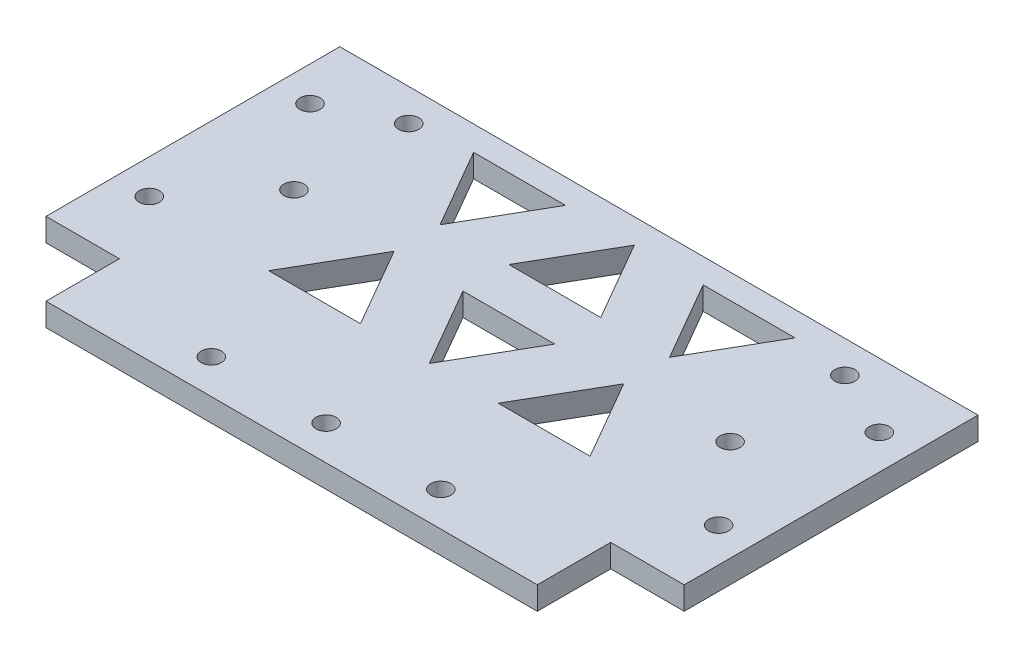
from build123d import *

# Parameters (mm, degrees)
SKETCH1_W               = 139
SKETCH1_H               = 160
BOSS_EXTRUDE1_DEPTH     = 5
SKETCH2_W               = 16
SKETCH2_H               = 16
CUT_EXTRUDE1_DEPTH      = 107.090763029
SKETCH3_R               = 2.2
CUT_EXTRUDE2_DEPTH      = 107.090763029
SKETCH4_R               = 2.2
CUT_EXTRUDE3_DEPTH      = 107.090763029
LPATTERN1_COUNT         = 4
LPATTERN1_PITCH         = 35
MIRROR2_COPY_1_SKETCH_R = 2.2
MIRROR2_COPY_1_DEPTH    = 107.090763029
MIRROR2_COPY_2_SKETCH_R = 2.2
MIRROR2_COPY_2_DEPTH    = 107.090763029
MIRROR2_COPY_3_SKETCH_R = 2.2
MIRROR2_COPY_3_DEPTH    = 107.090763029
SKETCH5_R               = 2.2
CUT_EXTRUDE4_DEPTH      = 107.090763029
CUT_EXTRUDE5_DEPTH      = 107.090763029
SKETCH9_W               = 139
SKETCH9_H               = 80
CUT_EXTRUDE6_DEPTH      = 10


with BuildPart() as part:
    # Sketch1 → Boss-Extrude1 (new body)
    with BuildSketch(Plane(origin=(0, 0, 0), x_dir=(1, 0, 0), z_dir=(0, 1, 0))):
        Rectangle(SKETCH1_W, SKETCH1_H)
    extrude(amount=BOSS_EXTRUDE1_DEPTH)

    # Sketch2 → Cut-Extrude1 (cut, through all)
    with BuildSketch(Plane(origin=(0, 5, 0), x_dir=(1, 0, 0), z_dir=(0, 1, 0))):
        with Locations((-61.5, -72)):
            Rectangle(SKETCH2_W, SKETCH2_H)
    cut_extrude1 = extrude(amount=-CUT_EXTRUDE1_DEPTH, mode=Mode.SUBTRACT)

    # Mirror1: Cut-Extrude1 across plane
    add(cut_extrude1.mirror(Plane(origin=(0, 0, 0), x_dir=(0, 0, 1), z_dir=(1, 0, 0))), mode=Mode.SUBTRACT)

    # Sketch3 → Cut-Extrude2 (cut, through all)
    with BuildSketch(Plane(origin=(0, 5, 0), x_dir=(1, 0, 0), z_dir=(0, 1, 0))):
        with Locations(Location((0, -72.5, 0), (0, 0, 270))):
            Circle(SKETCH3_R)
        with Locations(Location((-25, -72.5, 0), (0, 0, 270))):
            Circle(SKETCH3_R)
        with Locations(Location((25, -72.5, 0), (0, 0, 270))):
            Circle(SKETCH3_R)
    extrude(amount=-CUT_EXTRUDE2_DEPTH, mode=Mode.SUBTRACT)

    # Sketch4 → Cut-Extrude3 (cut, through all)
    with BuildSketch(Plane(origin=(0, 5, 0), x_dir=(1, 0, 0), z_dir=(0, 1, 0))):
        with Locations(Location((-62, -49, 0), (0, 0, 270))):
            Circle(SKETCH4_R)
    cut_extrude3 = extrude(amount=-CUT_EXTRUDE3_DEPTH, mode=Mode.SUBTRACT)

    # LPattern1: Cut-Extrude3 ×4
    with Locations(*[(0, 0, -i * LPATTERN1_PITCH) for i in range(1, LPATTERN1_COUNT)]):
        add(cut_extrude3, mode=Mode.SUBTRACT)

    # Mirror2: Cut-Extrude3 across plane
    add(cut_extrude3.mirror(Plane(origin=(0, 0, 0), x_dir=(0, 0, 1), z_dir=(1, 0, 0))), mode=Mode.SUBTRACT)

    # Mirror2 copy 1 sketch → Mirror2 copy 1 (cut, through all)
    with BuildSketch(Plane(origin=(0, 5, -35), x_dir=(-1, 0, 0), z_dir=(0, 1, 0))):
        with Locations((-62, 49)):
            Circle(MIRROR2_COPY_1_SKETCH_R)
    extrude(amount=-MIRROR2_COPY_1_DEPTH, mode=Mode.SUBTRACT)

    # Mirror2 copy 2 sketch → Mirror2 copy 2 (cut, through all)
    with BuildSketch(Plane(origin=(0, 5, -70), x_dir=(-1, 0, 0), z_dir=(0, 1, 0))):
        with Locations((-62, 49)):
            Circle(MIRROR2_COPY_2_SKETCH_R)
    extrude(amount=-MIRROR2_COPY_2_DEPTH, mode=Mode.SUBTRACT)

    # Mirror2 copy 3 sketch → Mirror2 copy 3 (cut, through all)
    with BuildSketch(Plane(origin=(0, 5, -105), x_dir=(-1, 0, 0), z_dir=(0, 1, 0))):
        with Locations((-62, 49)):
            Circle(MIRROR2_COPY_3_SKETCH_R)
    extrude(amount=-MIRROR2_COPY_3_DEPTH, mode=Mode.SUBTRACT)

    # Sketch5 → Cut-Extrude4 (cut, through all)
    with BuildSketch(Plane(origin=(0, 5, 0), x_dir=(1, 0, 0), z_dir=(0, 1, 0))):
        with Locations(Location((-47.5, -32, 0), (0, 0, 270))):
            Circle(SKETCH5_R)
        with Locations(Location((-47.5, -7, 0), (0, 0, 270))):
            Circle(SKETCH5_R)
    cut_extrude4 = extrude(amount=-CUT_EXTRUDE4_DEPTH, mode=Mode.SUBTRACT)

    # Mirror3: Cut-Extrude4 across plane
    add(cut_extrude4.mirror(Plane(origin=(0, 0, 0), x_dir=(0, 0, 1), z_dir=(1, 0, 0))), mode=Mode.SUBTRACT)

    # Sketch6 → Cut-Extrude5 (cut, through all)
    with BuildSketch(Plane(origin=(0, 5, 0), x_dir=(1, 0, 0), z_dir=(0, 1, 0))):
        Polygon((0, 50), (-10, 32.679491924), (10, 32.679491924), align=None)
        Polygon((15, 50), (25, 32.679491924), (35, 50), align=None)
        Polygon((-25, 32.679491924), (-35, 50), (-15, 50), align=None)
        Polygon((25, 22.679491924), (35, 5.358983849), (15, 5.358983849), align=None)
        Polygon((-10, 22.679491924), (10, 22.679491924), (0, 5.358983849), align=None)
        Polygon((-15, 5.358983849), (-25, 22.679491924), (-35, 5.358983849), align=None)
        Polygon((15, -5.358983849), (25, -22.679491924), (35, -5.358983849), align=None)
        Polygon((0, -5.358983849), (-10, -22.679491924), (10, -22.679491924), align=None)
        Polygon((-35, -5.358983849), (-15, -5.358983849), (-25, -22.679491924), align=None)
        Polygon((25, -32.679491924), (35, -50), (15, -50), align=None)
        Polygon((-10, -32.679491924), (10, -32.679491924), (0, -50), align=None)
        Polygon((-15, -50), (-25, -32.679491924), (-35, -50), align=None)
    extrude(amount=-CUT_EXTRUDE5_DEPTH, mode=Mode.SUBTRACT)

    # Sketch9 → Cut-Extrude6 (cut)
    with BuildSketch(Plane(origin=(0, 5, 0), x_dir=(1, 0, 0), z_dir=(0, 1, 0))):
        with Locations((0, 40)):
            Rectangle(SKETCH9_W, SKETCH9_H)
    extrude(amount=-CUT_EXTRUDE6_DEPTH, mode=Mode.SUBTRACT)


solid = part.part
